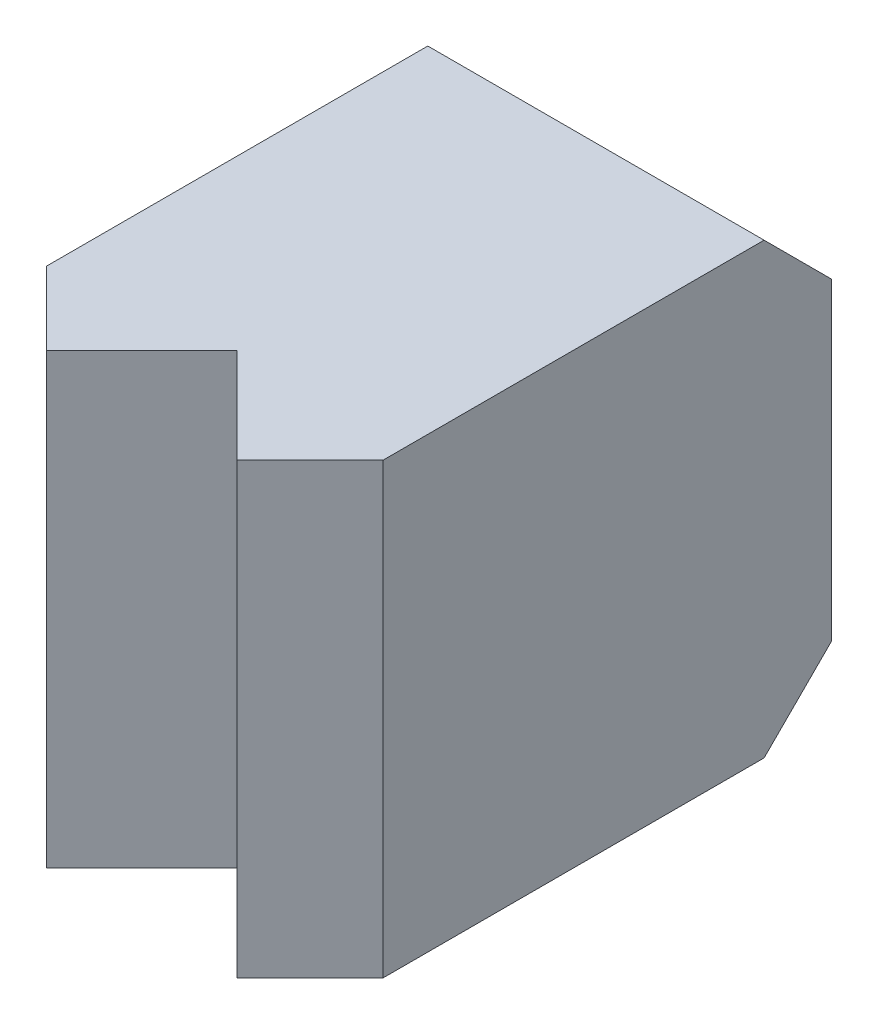
from build123d import *

# Parameters (mm, degrees)
EXTRUDE_1_DEPTH     = 20
SKETCH_2_R          = 5
CUT_EXTRUDE_1_DEPTH = 18
CHAMFER_1_SIZE      = 3


with BuildPart() as part:
    # 草圖1 → 填料-伸長1 (new body)
    with BuildSketch(Plane(origin=(0, 0, 0), x_dir=(1, 0, 0), z_dir=(0, 1, 0))):
        Polygon((0, 0), (0, -20), (3.257359313, -23.257359313), (7.5, -19.014718626), (11.742640687, -23.257359313), (15, -20), (15, 0), align=None)
    extrude(amount=EXTRUDE_1_DEPTH)

    # 草圖2 → 除料-伸長1 (cut)
    with BuildSketch(Plane(origin=(0, 0, 0), x_dir=(-1, 0, 0), z_dir=(0, 0, -1))):
        with Locations((-7.5, 10)):
            Circle(SKETCH_2_R)
    extrude(amount=-CUT_EXTRUDE_1_DEPTH, mode=Mode.SUBTRACT)

    # 導角1
    chamfer_1_edges = [part.edges().sort_by_distance(p)[0] for p in [
        (7.5, 20, 0),
        (7.5, 0, 0),
    ]]
    chamfer(chamfer_1_edges, length=CHAMFER_1_SIZE)


solid = part.part
